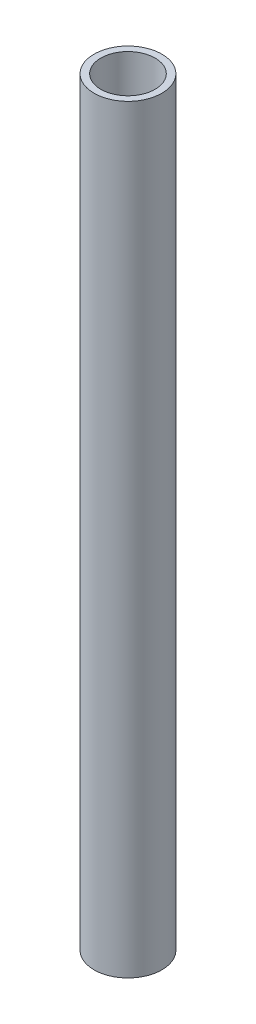
from build123d import *

# Parameters (mm, degrees)
SKETCH_1_R      = 1.25
SKETCH_1_R_2    = 1
EXTRUDE_1_DEPTH = 28


with BuildPart() as part:
    # Эскиз1 → Бобышка-Вытянуть1 (new body)
    with BuildSketch(Plane(origin=(0, 0, 0), x_dir=(1, 0, 0), z_dir=(0, 1, 0))):
        with Locations(Location((0, 0, 0), (0, 0, 270))):
            Circle(SKETCH_1_R)
        with Locations(Location((0, 0, 0), (0, 0, 270))):
            Circle(SKETCH_1_R_2, mode=Mode.SUBTRACT)
    extrude(amount=EXTRUDE_1_DEPTH)


solid = part.part
